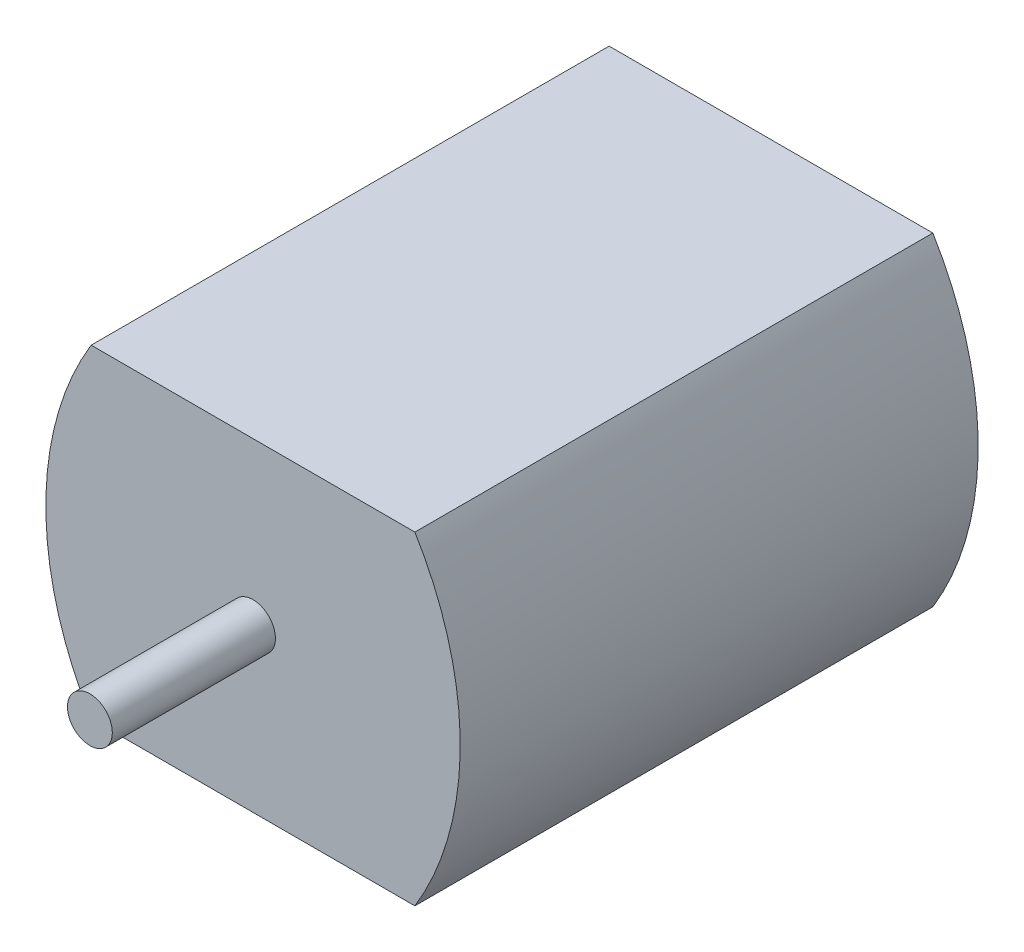
from build123d import *

# Parameters (mm, degrees)
BOSS_EXTRUDE1_DEPTH = 25.4
SKETCH2_R           = 1.1
BOSS_EXTRUDE2_DEPTH = 8


with BuildPart() as part:
    # Sketch1 → Boss-Extrude1 (new body)
    with BuildSketch(Plane.XY):
        with BuildLine():
            Line((0, 0), (-15.875, 0))
            ThreePointArc((-15.875, 0), (-18.0975, 7.9375), (-15.875, 15.875))
            Line((-15.875, 15.875), (0, 15.875))
            ThreePointArc((0, 15.875), (2.2225, 7.9375), (0, 0))
        make_face()
    extrude(amount=BOSS_EXTRUDE1_DEPTH)

    # Sketch2 → Boss-Extrude2 (add)
    with BuildSketch(Plane.XY.offset(25.4)):
        with Locations(Location((-7.9375, 7.9375, 0), (0, 0, 180))):
            Circle(SKETCH2_R)
    extrude(amount=BOSS_EXTRUDE2_DEPTH)


solid = part.part
